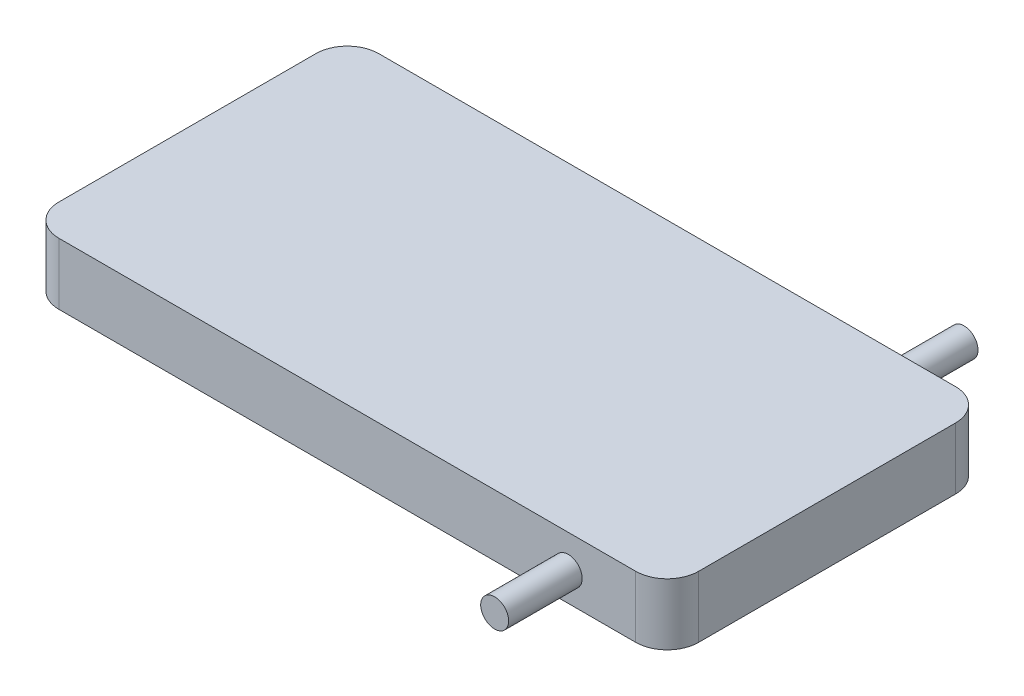
from build123d import *

# Parameters (mm, degrees)
SKETCH2_W           = 203.2
SKETCH2_H           = 101.6
BOSS_EXTRUDE1_DEPTH = 19.558
FILLET1_R           = 10
FILLET2_R           = 10
FILLET3_R           = 10
FILLET4_R           = 10
SKETCH3_R           = 4.445
BOSS_EXTRUDE3_DEPTH = 24.13
SKETCH4_R           = 19.05
CUT_EXTRUDE1_DEPTH  = 2.54


with BuildPart() as part:
    # Sketch2 → Boss-Extrude1 (new body)
    with BuildSketch(Plane(origin=(-97.482495003, 0, 34.735141898), x_dir=(1, 0, 0), z_dir=(0, 1, 0))):
        with Locations((-19.545959724, 34.347881976)):
            Rectangle(SKETCH2_W, SKETCH2_H)
    extrude(amount=BOSS_EXTRUDE1_DEPTH)

    # Fillet1
    fillet1_edges = [part.edges().sort_by_distance(p)[0] for p in [
        (-15.428454726, 9.779, 51.187259921),
    ]]
    fillet(fillet1_edges, radius=FILLET1_R)

    # Fillet2
    fillet2_edges = [part.edges().sort_by_distance(p)[0] for p in [
        (-218.628454726, 9.779, -50.412740079),
    ]]
    fillet(fillet2_edges, radius=FILLET2_R)

    # Fillet3
    fillet3_edges = [part.edges().sort_by_distance(p)[0] for p in [
        (-218.628454726, 9.779, 51.187259921),
    ]]
    fillet(fillet3_edges, radius=FILLET3_R)

    # Fillet4
    fillet4_edges = [part.edges().sort_by_distance(p)[0] for p in [
        (-15.428454726, 9.779, -50.412740079),
    ]]
    fillet(fillet4_edges, radius=FILLET4_R)

    # Sketch3 → Boss-Extrude3 (add)
    with BuildSketch(Plane(origin=(0, 0, -50.412740079), x_dir=(-1, 0, 0), z_dir=(0, 0, -1))):
        with Locations(Location((46.871325594, 9.049463129, 0), (0, 0, 180))):
            Circle(SKETCH3_R)
    boss_extrude3 = extrude(amount=BOSS_EXTRUDE3_DEPTH)

    # Mirror2: Boss-Extrude3 across plane
    add(boss_extrude3.mirror(Plane.XY))

    # Sketch4 → Cut-Extrude1 (cut)
    with BuildSketch(Plane.XZ):
        with Locations(Location((-175.512993917, 2.188610614, 0), (0, 0, 270))):
            Circle(SKETCH4_R)
    extrude(amount=-CUT_EXTRUDE1_DEPTH, mode=Mode.SUBTRACT)


solid = part.part
